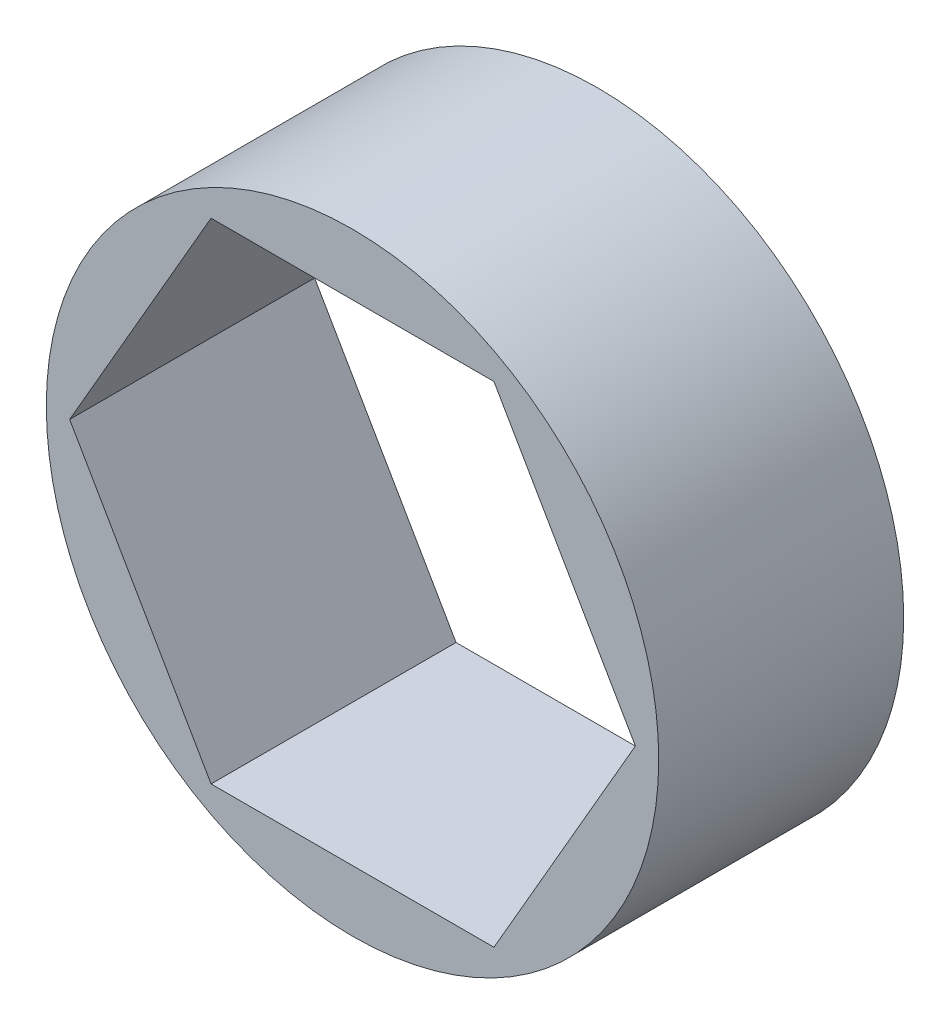
from build123d import *

# Parameters (mm, degrees)
SKETCH1_R           = 7.9375
BOSS_EXTRUDE1_DEPTH = 6.35


with BuildPart() as part:
    # Sketch1 → Boss-Extrude1 (new body)
    with BuildSketch(Plane.XY):
        Circle(SKETCH1_R)
        Polygon((-3.666174209, -6.35), (3.666174209, -6.35), (7.332348419, 0), (3.666174209, 6.35), (-3.666174209, 6.35), (-7.332348419, 0), align=None, mode=Mode.SUBTRACT)
    extrude(amount=BOSS_EXTRUDE1_DEPTH)


solid = part.part
